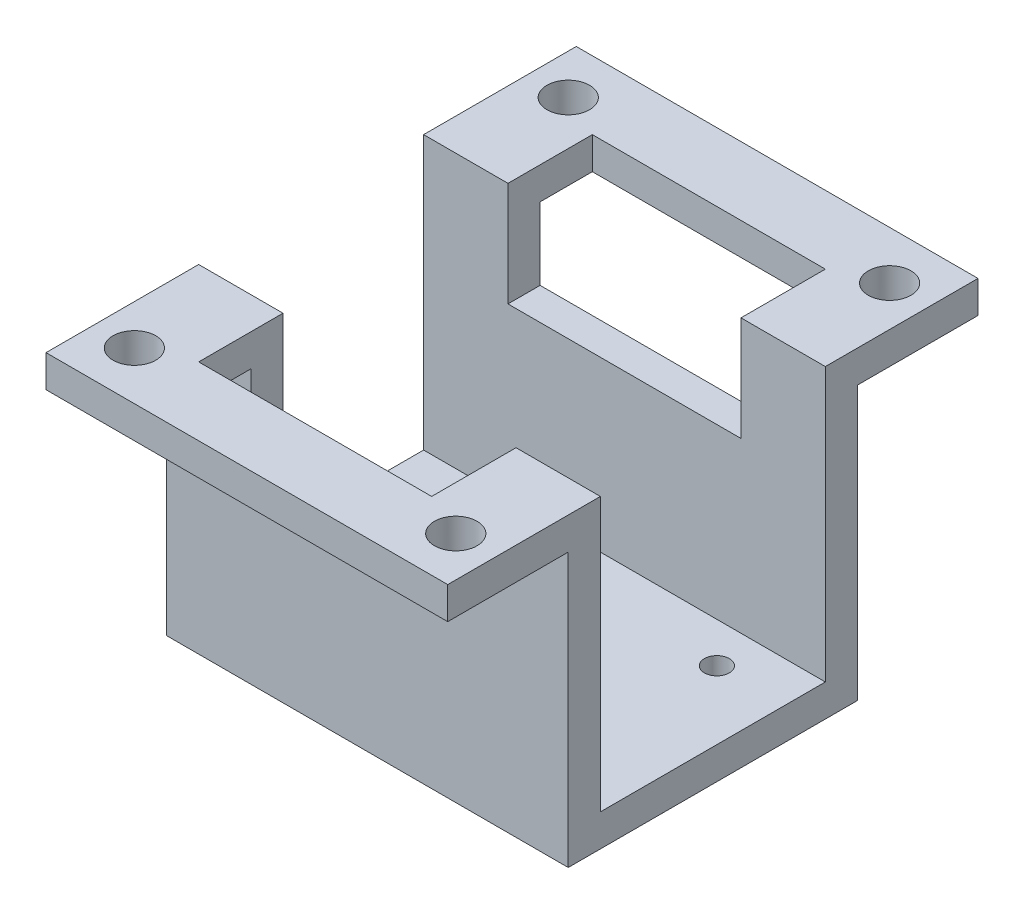
from build123d import *

# Parameters (mm, degrees)
SKETCH1_W           = 50
SKETCH1_H           = 36
SKETCH1_R           = 1.55
SKETCH1_R_2         = 8
BOSS_EXTRUDE1_DEPTH = 4
SKETCH2_W           = 50
SKETCH2_H           = 4
BOSS_EXTRUDE3_DEPTH = 34
SKETCH3_W           = 29
SKETCH3_H           = 13
CUT_EXTRUDE1_DEPTH  = 67.80007485
BOSS_EXTRUDE4_DEPTH = 15
SKETCH7_W           = 50
SKETCH7_H           = 4
BOSS_EXTRUDE5_DEPTH = 15
SKETCH9_W           = 29
SKETCH9_H           = 6.5
CUT_EXTRUDE2_DEPTH  = 71.215738976
SKETCH10_R          = 2.65
CUT_EXTRUDE3_DEPTH  = 69.134059031


with BuildPart() as part:
    # Sketch1 → Boss-Extrude1 (new body)
    with BuildSketch(Plane(origin=(0, 0, 0), x_dir=(1, 0, 0), z_dir=(0, 1, 0))):
        with Locations((16.5, 9)):
            Rectangle(SKETCH1_W, SKETCH1_H)
        with Locations(Location((0, 18, 0), (0, 0, 270))):
            Circle(SKETCH1_R, mode=Mode.SUBTRACT)
        with Locations(Location((0, 0, 0), (0, 0, 270))):
            Circle(SKETCH1_R, mode=Mode.SUBTRACT)
        with Locations(Location((33, 0, 0), (0, 0, 270))):
            Circle(SKETCH1_R, mode=Mode.SUBTRACT)
        with Locations(Location((33, 18, 0), (0, 0, 270))):
            Circle(SKETCH1_R, mode=Mode.SUBTRACT)
        with Locations(Location((9, 9, 0), (0, 0, 270))):
            Circle(SKETCH1_R_2, mode=Mode.SUBTRACT)
    extrude(amount=BOSS_EXTRUDE1_DEPTH)

    # Sketch2 → Boss-Extrude3 (add)
    with BuildSketch(Plane(origin=(0, 4, 0), x_dir=(1, 0, 0), z_dir=(0, 1, 0))):
        with Locations((16.5, -7)):
            Rectangle(SKETCH2_W, SKETCH2_H)
        with Locations((16.5, 25)):
            Rectangle(SKETCH2_W, SKETCH2_H)
    extrude(amount=BOSS_EXTRUDE3_DEPTH)

    # Sketch3 → Cut-Extrude1 (cut, through all)
    with BuildSketch(Plane.XY.offset(9)):
        with Locations((16.5, 31.5)):
            Rectangle(SKETCH3_W, SKETCH3_H)
    extrude(amount=-CUT_EXTRUDE1_DEPTH, mode=Mode.SUBTRACT)

    # Sketch6 → Boss-Extrude4 (add)
    with BuildSketch(Plane.XY.offset(9)):
        Polygon((31, 38), (41.5, 38), (41.5, 34), (2, 34), (-8.5, 34), (-8.5, 38), align=None)
    extrude(amount=BOSS_EXTRUDE4_DEPTH)

    # Sketch7 → Boss-Extrude5 (add)
    with BuildSketch(Plane(origin=(0, 0, -27), x_dir=(-1, 0, 0), z_dir=(0, 0, -1))):
        with Locations((-16.5, 36)):
            Rectangle(SKETCH7_W, SKETCH7_H)
    extrude(amount=BOSS_EXTRUDE5_DEPTH)

    # Sketch9 → Cut-Extrude2 (cut, through all)
    with BuildSketch(Plane(origin=(0, 38, 0), x_dir=(1, 0, 0), z_dir=(0, 1, 0))):
        with Locations((16.5, 30.25)):
            Rectangle(SKETCH9_W, SKETCH9_H)
        with Locations((16.5, -12.25)):
            Rectangle(SKETCH9_W, SKETCH9_H)
    extrude(amount=-CUT_EXTRUDE2_DEPTH, mode=Mode.SUBTRACT)

    # Sketch10 → Cut-Extrude3 (cut, through all)
    with BuildSketch(Plane.XZ.offset(-34)):
        with Locations(Location((36.5, -36, 0), (0, 0, 270))):
            Circle(SKETCH10_R)
        with Locations(Location((-3.5, -36, 0), (0, 0, 270))):
            Circle(SKETCH10_R)
        with Locations(Location((-3.5, 18, 0), (0, 0, 270))):
            Circle(SKETCH10_R)
        with Locations(Location((36.5, 18, 0), (0, 0, 270))):
            Circle(SKETCH10_R)
    extrude(amount=-CUT_EXTRUDE3_DEPTH, mode=Mode.SUBTRACT)


solid = part.part
